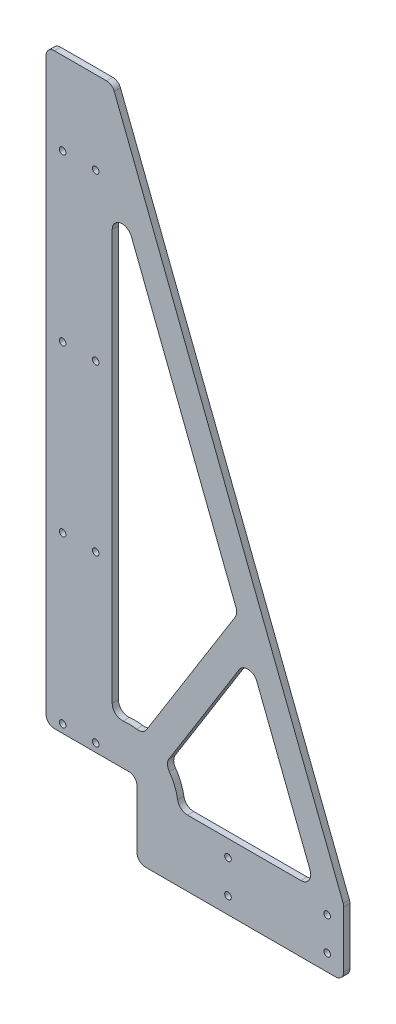
from build123d import *

# Parameters (mm, degrees)
SKETCH1_R           = 2.54
BOSS_EXTRUDE1_DEPTH = 4.7625
FILLET1_R           = 6.35
CUT_EXTRUDE1_DEPTH  = 558.08584743
FILLET2_R           = 7.62


with BuildPart() as part:
    # Sketch1 → Boss-Extrude1 (new body)
    with BuildSketch(Plane.XY):
        Polygon((69.85, 0), (69.85, 57.15), (0, 57.15), (0, 508), (50.8, 508), (228.6, 50.8), (228.6, 0), align=None)
        with Locations(Location((12.7, 63.5, 0), (0, 0, 180))):
            Circle(SKETCH1_R, mode=Mode.SUBTRACT)
        with Locations(Location((38.1, 63.5, 0), (0, 0, 180))):
            Circle(SKETCH1_R, mode=Mode.SUBTRACT)
        with Locations(Location((38.1, 190.5, 0), (0, 0, 180))):
            Circle(SKETCH1_R, mode=Mode.SUBTRACT)
        with Locations(Location((12.7, 190.5, 0), (0, 0, 180))):
            Circle(SKETCH1_R, mode=Mode.SUBTRACT)
        with Locations(Location((38.1, 317.5, 0), (0, 0, 180))):
            Circle(SKETCH1_R, mode=Mode.SUBTRACT)
        with Locations(Location((12.7, 317.5, 0), (0, 0, 180))):
            Circle(SKETCH1_R, mode=Mode.SUBTRACT)
        with Locations(Location((139.7, 12.7, 0), (0, 0, 180))):
            Circle(SKETCH1_R, mode=Mode.SUBTRACT)
        with Locations(Location((139.7, 38.1, 0), (0, 0, 180))):
            Circle(SKETCH1_R, mode=Mode.SUBTRACT)
        with Locations(Location((215.9, 12.7, 0), (0, 0, 180))):
            Circle(SKETCH1_R, mode=Mode.SUBTRACT)
        with Locations(Location((215.9, 38.1, 0), (0, 0, 180))):
            Circle(SKETCH1_R, mode=Mode.SUBTRACT)
        with Locations(Location((38.1, 444.5, 0), (0, 0, 180))):
            Circle(SKETCH1_R, mode=Mode.SUBTRACT)
        with Locations(Location((12.7, 444.5, 0), (0, 0, 180))):
            Circle(SKETCH1_R, mode=Mode.SUBTRACT)
    extrude(amount=BOSS_EXTRUDE1_DEPTH)

    # Fillet1
    fillet1_edges = [part.edges().sort_by_distance(p)[0] for p in [
        (0, 508, 2.38125),
        (50.8, 508, 2.38125),
        (228.6, 50.8, 2.38125),
        (228.6, 0, 2.38125),
        (69.85, 0, 2.38125),
        (69.85, 57.15, 2.38125),
        (0, 57.15, 2.38125),
    ]]
    fillet(fillet1_edges, radius=FILLET1_R)

    # Sketch2 → Cut-Extrude1 (cut, through all)
    with BuildSketch(Plane.XY.offset(4.7625)):
        with BuildLine():
            ThreePointArc((91.574991646, 76.5566466), (99.005402277, 64.619421447), (101.6, 50.8))
            Line((101.6, 50.8), (206.797534175, 50.8))
            Line((206.797534175, 50.8), (156.422847293, 180.334909125))
            Line((156.422847293, 180.334909125), (91.574991646, 76.5566466))
        make_face()
        with BuildLine():
            ThreePointArc((50.8, 86.721024484), (62.523521168, 88.887484678), (74.342654332, 87.324606049))
            Line((74.342654332, 87.324606049), (147.2311787, 203.970628365))
            Line((147.2311787, 203.970628365), (50.8, 451.93651645))
            Line((50.8, 451.93651645), (50.8, 86.721024484))
        make_face()
    extrude(amount=-CUT_EXTRUDE1_DEPTH, mode=Mode.SUBTRACT)

    # Fillet2
    fillet2_edges = [part.edges().sort_by_distance(p)[0] for p in [
        (50.8, 86.721024484, 2.38125),
        (50.8, 451.93651645, 2.38125),
        (147.2311787, 203.970628365, 2.38125),
        (74.342654332, 87.324606049, 2.38125),
        (91.574991646, 76.5566466, 2.38125),
        (156.422847293, 180.334909125, 2.38125),
        (206.797534175, 50.8, 2.38125),
        (101.6, 50.8, 2.38125),
    ]]
    fillet(fillet2_edges, radius=FILLET2_R)


solid = part.part
